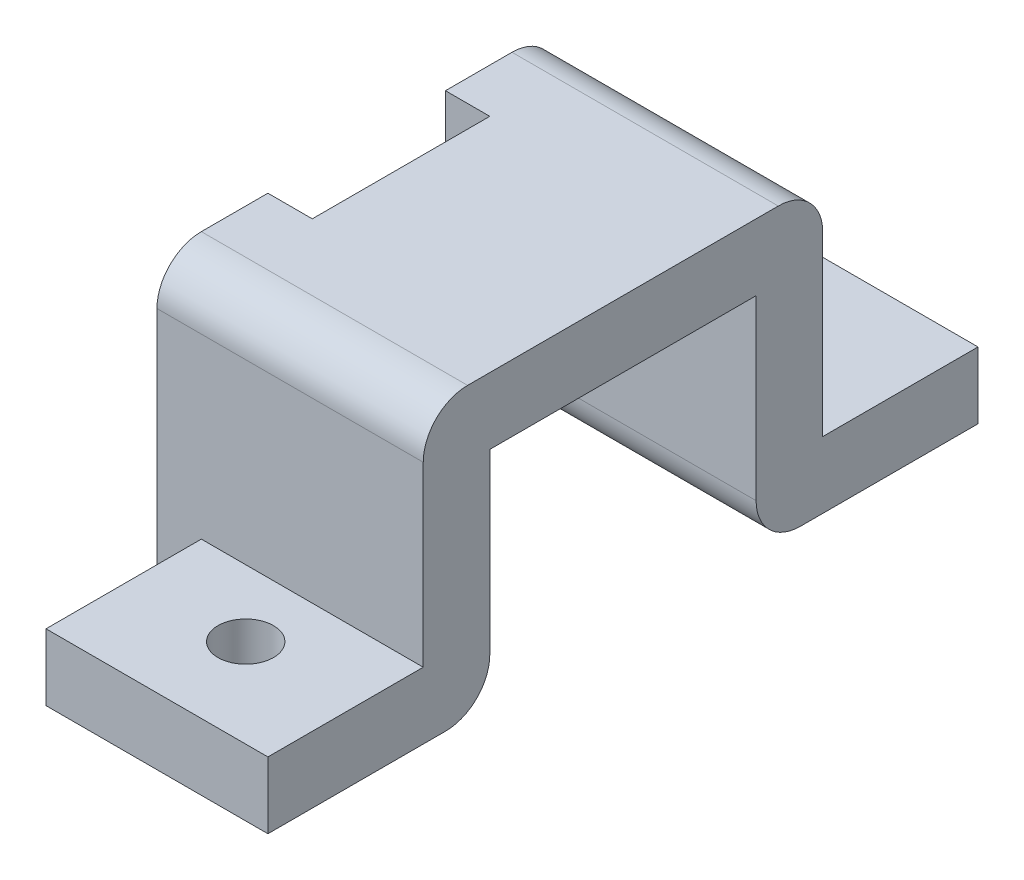
from build123d import *

# Parameters (mm, degrees)
MAIN_DEPTH      = 10
FILLET1_R       = 2
FILLET2_R       = 2
SKETCH2_R       = 1.25
BOLT_SLOT_DEPTH = 3
SKETCH3_W       = 5
SKETCH3_H       = 13
FRONT_TAB_DEPTH = 2
SKETCH4_W       = 1.5
SKETCH4_H       = 5
TOP_TAB_DEPTH   = 2
FILLET3_R       = 2
FILLET4_R       = 2


with BuildPart() as part:
    # Sketch1 → main (new body)
    with BuildSketch(Plane(origin=(0, 0, 0), x_dir=(0, 0, -1), z_dir=(1, 0, 0))):
        Polygon((-9, 0), (9, 0), (9, -10), (16, -10), (16, -13), (6, -13), (6, -3), (-6, -3), (-6, -13), (-16, -13), (-16, -10), (-9, -10), align=None)
    extrude(amount=MAIN_DEPTH)

    # Fillet1
    fillet1_edges = [part.edges().sort_by_distance(p)[0] for p in [
        (5, -13, 6),
    ]]
    fillet(fillet1_edges, radius=FILLET1_R)

    # Fillet2
    fillet2_edges = [part.edges().sort_by_distance(p)[0] for p in [
        (5, -13, -6),
    ]]
    fillet(fillet2_edges, radius=FILLET2_R)

    # Sketch2 → bolt slot (cut)
    with BuildSketch(Plane.XZ.offset(13)):
        with Locations(Location((5, 12, 0), (0, 0, 270))):
            Circle(SKETCH2_R)
        with Locations(Location((5, -12, 0), (0, 0, 270))):
            Circle(SKETCH2_R)
    extrude(amount=-BOLT_SLOT_DEPTH, mode=Mode.SUBTRACT)

    # Sketch3 → front tab (add)
    with BuildSketch(Plane.ZY):
        with Locations((-6.5, -6.5)):
            Rectangle(SKETCH3_W, SKETCH3_H)
        with Locations((6.5, -6.5)):
            Rectangle(SKETCH3_W, SKETCH3_H)
    extrude(amount=FRONT_TAB_DEPTH)

    # Sketch4 → top tab (add)
    with BuildSketch(Plane.XZ.offset(3)):
        with Locations((7.25, -3.5)):
            Rectangle(SKETCH4_W, SKETCH4_H)
    extrude(amount=TOP_TAB_DEPTH)

    # Fillet3
    fillet3_edges = [part.edges().sort_by_distance(p)[0] for p in [
        (4, 0, -9),
    ]]
    fillet(fillet3_edges, radius=FILLET3_R)

    # Fillet4
    fillet4_edges = [part.edges().sort_by_distance(p)[0] for p in [
        (4, 0, 9),
    ]]
    fillet(fillet4_edges, radius=FILLET4_R)


solid = part.part
